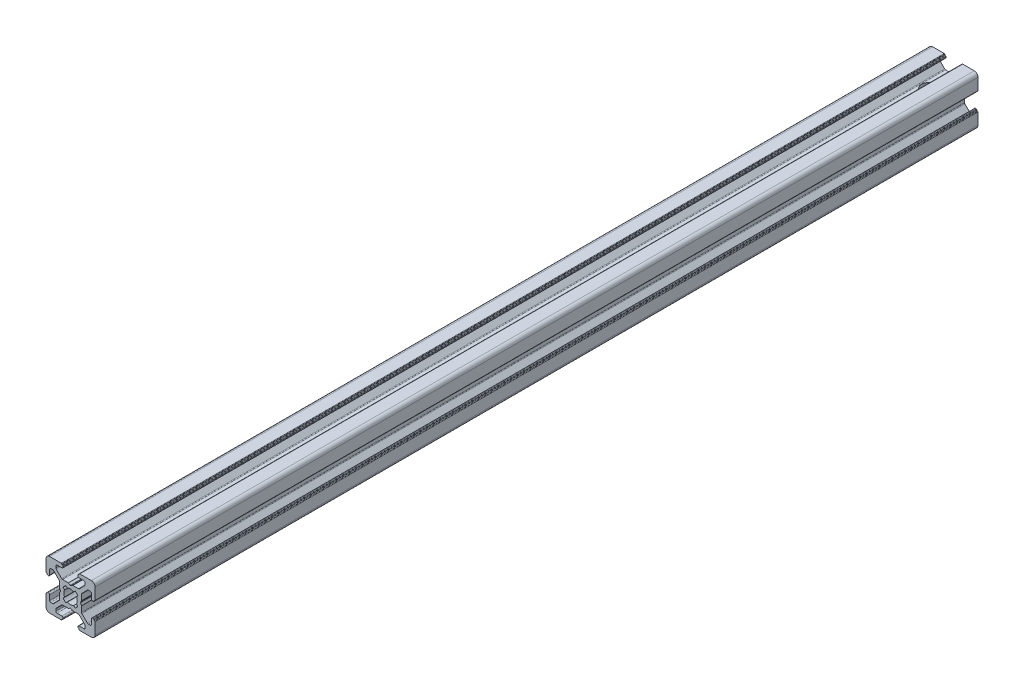
from build123d import *

# Parameters (mm, degrees)
Y_KSEKLIK_EKSTR_ZYON1_DEPTH = 180
IZIM2_R                     = 3
KES_EKSTR_ZYON1_DEPTH       = 36


with BuildPart() as part:
    # Çizim1 → Yükseklik-Ekstrüzyon1 (new, symmetric)
    with BuildSketch(Plane.XY):
        with BuildLine():
            Line((-3.750000227, 10), (-8.5, 10))
            ThreePointArc((-8.5, 10), (-9.560660172, 9.560660172), (-10, 8.5))
            Line((-10, 8.5), (-10, 3.749999605))
            ThreePointArc((-10, 3.749999605), (-9.941421356, 3.608578248), (-9.8, 3.549999605))
            Line((-9.8, 3.549999605), (-9.699999732, 3.549999605))
            ThreePointArc((-9.699999732, 3.549999605), (-9.558578376, 3.491420961), (-9.499999732, 3.349999605))
            Line((-9.499999732, 3.349999605), (-9.499999732, 3.2))
            ThreePointArc((-9.499999732, 3.2), (-9.441421088, 3.058578644), (-9.299999732, 3))
            Line((-9.299999732, 3), (-8.999999732, 3))
            ThreePointArc((-8.999999732, 3), (-8.646446341, 3.146446609), (-8.499999732, 3.5))
            Line((-8.499999732, 3.5), (-8.499999732, 5.499999605))
            ThreePointArc((-8.499999732, 5.499999605), (-8.353553123, 5.853552995), (-7.999999732, 5.999999605))
            Line((-7.999999732, 5.999999605), (-7.267766685, 5.999999605))
            ThreePointArc((-7.267766685, 5.999999605), (-7.076424969, 5.961939371), (-6.914213294, 5.853552995))
            Line((-6.914213294, 5.853552995), (-4.646446398, 3.585786099))
            ThreePointArc((-4.646446398, 3.585786099), (-4.538060023, 3.423574425), (-4.499999789, 3.232232709))
            Line((-4.499999789, 3.232232709), (-4.499999789, 0.953589302))
            ThreePointArc((-4.499999789, 0.953589302), (-4.493184953, 0.90182549), (-4.473204867, 0.853589298))
            Line((-4.473204867, 0.853589298), (-4.038119841, 0.099999969))
            ThreePointArc((-4.038119841, 0.099999969), (-4.011324929, 0), (-4.038119841, -0.099999969))
            Line((-4.038119841, -0.099999969), (-4.473204867, -0.853589297))
            ThreePointArc((-4.473204867, -0.853589297), (-4.493184953, -0.90182549), (-4.499999789, -0.953589302))
            Line((-4.499999789, -0.953589302), (-4.499999789, -3.232232708))
            ThreePointArc((-4.499999789, -3.232232708), (-4.538060023, -3.423574425), (-4.646446398, -3.585786099))
            Line((-4.646446398, -3.585786099), (-6.914213294, -5.853552995))
            ThreePointArc((-6.914213294, -5.853552995), (-7.076424969, -5.961939371), (-7.267766685, -5.999999605))
            Line((-7.267766685, -5.999999605), (-7.999999732, -5.999999605))
            ThreePointArc((-7.999999732, -5.999999605), (-8.353553123, -5.853552995), (-8.499999732, -5.499999605))
            Line((-8.499999732, -5.499999605), (-8.499999732, -3.5))
            ThreePointArc((-8.499999732, -3.5), (-8.646446341, -3.146446609), (-8.999999732, -3))
            Line((-8.999999732, -3), (-9.299999732, -3))
            ThreePointArc((-9.299999732, -3), (-9.441421088, -3.058578644), (-9.499999732, -3.2))
            Line((-9.499999732, -3.2), (-9.499999732, -3.349999605))
            ThreePointArc((-9.499999732, -3.349999605), (-9.558578376, -3.491420961), (-9.699999732, -3.549999605))
            Line((-9.699999732, -3.549999605), (-9.8, -3.549999605))
            ThreePointArc((-9.8, -3.549999605), (-9.941421356, -3.608578248), (-10, -3.749999605))
            Line((-10, -3.749999605), (-10, -8.5))
            ThreePointArc((-10, -8.5), (-9.560660172, -9.560660172), (-8.5, -10))
            Line((-8.5, -10), (-3.750000227, -10))
            ThreePointArc((-3.750000227, -10), (-3.608578871, -9.941421356), (-3.550000227, -9.8))
            Line((-3.550000227, -9.8), (-3.550000227, -9.7))
            ThreePointArc((-3.550000227, -9.7), (-3.491421584, -9.558578644), (-3.350000227, -9.5))
            Line((-3.350000227, -9.5), (-3.2, -9.5))
            ThreePointArc((-3.2, -9.5), (-3.058578644, -9.441421356), (-3, -9.3))
            Line((-3, -9.3), (-3, -8.999999673))
            ThreePointArc((-3, -8.999999673), (-3.146446609, -8.646446283), (-3.5, -8.499999673))
            Line((-3.5, -8.499999673), (-5.500000686, -8.499999673))
            ThreePointArc((-5.500000686, -8.499999673), (-5.853554077, -8.353553064), (-6.000000686, -7.999999673))
            Line((-6.000000686, -7.999999673), (-6.000000686, -7.267766626))
            ThreePointArc((-6.000000686, -7.267766626), (-5.961940448, -7.076424899), (-5.853554059, -6.914213219))
            Line((-5.853554059, -6.914213219), (-3.585787212, -4.646446592))
            ThreePointArc((-3.585787212, -4.646446592), (-3.423575544, -4.538060229), (-3.232233839, -4.5))
            Line((-3.232233839, -4.5), (-0.953590312, -4.5))
            ThreePointArc((-0.953590312, -4.5), (-0.901826505, -4.493185166), (-0.853590316, -4.473205083))
            Line((-0.853590316, -4.473205083), (-0.100000045, -4.038119562))
            ThreePointArc((-0.100000045, -4.038119562), (0, -4.011324632), (0.100000045, -4.038119562))
            Line((0.100000045, -4.038119562), (0.853590316, -4.473205083))
            ThreePointArc((0.853590316, -4.473205083), (0.901826505, -4.493185166), (0.953590312, -4.5))
            Line((0.953590312, -4.5), (3.232233839, -4.5))
            ThreePointArc((3.232233839, -4.5), (3.423575544, -4.538060229), (3.585787212, -4.646446592))
            Line((3.585787212, -4.646446592), (5.853554059, -6.914213218))
            ThreePointArc((5.853554059, -6.914213218), (5.961940448, -7.076424899), (6.000000686, -7.267766626))
            Line((6.000000686, -7.267766626), (6.000000686, -7.999999673))
            ThreePointArc((6.000000686, -7.999999673), (5.853554077, -8.353553064), (5.500000686, -8.499999673))
            Line((5.500000686, -8.499999673), (3.5, -8.499999673))
            ThreePointArc((3.5, -8.499999673), (3.146446609, -8.646446283), (3, -8.999999673))
            Line((3, -8.999999673), (3, -9.3))
            ThreePointArc((3, -9.3), (3.058578644, -9.441421356), (3.2, -9.5))
            Line((3.2, -9.5), (3.350000228, -9.5))
            ThreePointArc((3.350000228, -9.5), (3.491421584, -9.558578644), (3.550000228, -9.7))
            Line((3.550000228, -9.7), (3.550000228, -9.8))
            ThreePointArc((3.550000228, -9.8), (3.608578871, -9.941421356), (3.750000228, -10))
            Line((3.750000228, -10), (8.5, -10))
            ThreePointArc((8.5, -10), (9.560660172, -9.560660172), (10, -8.5))
            Line((10, -8.5), (10, -3.749999605))
            ThreePointArc((10, -3.749999605), (9.941421356, -3.608578248), (9.8, -3.549999605))
            Line((9.8, -3.549999605), (9.699999732, -3.549999605))
            ThreePointArc((9.699999732, -3.549999605), (9.558578376, -3.491420961), (9.499999732, -3.349999605))
            Line((9.499999732, -3.349999605), (9.499999732, -3.2))
            ThreePointArc((9.499999732, -3.2), (9.441421088, -3.058578644), (9.299999732, -3))
            Line((9.299999732, -3), (8.999999732, -3))
            ThreePointArc((8.999999732, -3), (8.646446341, -3.146446609), (8.499999732, -3.5))
            Line((8.499999732, -3.5), (8.499999732, -5.499999605))
            ThreePointArc((8.499999732, -5.499999605), (8.353553123, -5.853552995), (7.999999732, -5.999999605))
            Line((7.999999732, -5.999999605), (7.267766685, -5.999999605))
            ThreePointArc((7.267766685, -5.999999605), (7.076424969, -5.961939371), (6.914213294, -5.853552995))
            Line((6.914213294, -5.853552995), (4.646446398, -3.585786099))
            ThreePointArc((4.646446398, -3.585786099), (4.538060023, -3.423574425), (4.499999789, -3.232232708))
            Line((4.499999789, -3.232232708), (4.499999789, -0.953589302))
            ThreePointArc((4.499999789, -0.953589302), (4.493184953, -0.90182549), (4.473204867, -0.853589297))
            Line((4.473204867, -0.853589297), (4.038119841, -0.099999969))
            ThreePointArc((4.038119841, -0.099999969), (4.011324929, 0), (4.038119841, 0.099999969))
            Line((4.038119841, 0.099999969), (4.473204867, 0.853589298))
            ThreePointArc((4.473204867, 0.853589298), (4.493184953, 0.90182549), (4.499999789, 0.953589302))
            Line((4.499999789, 0.953589302), (4.499999789, 3.232232709))
            ThreePointArc((4.499999789, 3.232232709), (4.538060023, 3.423574425), (4.646446398, 3.585786099))
            Line((4.646446398, 3.585786099), (6.914213294, 5.853552995))
            ThreePointArc((6.914213294, 5.853552995), (7.076424969, 5.961939371), (7.267766685, 5.999999605))
            Line((7.267766685, 5.999999605), (7.999999732, 5.999999605))
            ThreePointArc((7.999999732, 5.999999605), (8.353553123, 5.853552995), (8.499999732, 5.499999605))
            Line((8.499999732, 5.499999605), (8.499999732, 3.5))
            ThreePointArc((8.499999732, 3.5), (8.646446341, 3.146446609), (8.999999732, 3))
            Line((8.999999732, 3), (9.299999732, 3))
            ThreePointArc((9.299999732, 3), (9.441421088, 3.058578644), (9.499999732, 3.2))
            Line((9.499999732, 3.2), (9.499999732, 3.349999605))
            ThreePointArc((9.499999732, 3.349999605), (9.558578376, 3.491420961), (9.699999732, 3.549999605))
            Line((9.699999732, 3.549999605), (9.8, 3.549999605))
            ThreePointArc((9.8, 3.549999605), (9.941421356, 3.608578248), (10, 3.749999605))
            Line((10, 3.749999605), (10, 8.5))
            ThreePointArc((10, 8.5), (9.560660172, 9.560660172), (8.5, 10))
            Line((8.5, 10), (3.750000228, 10))
            ThreePointArc((3.750000228, 10), (3.608578871, 9.941421356), (3.550000228, 9.8))
            Line((3.550000228, 9.8), (3.550000228, 9.7))
            ThreePointArc((3.550000228, 9.7), (3.491421584, 9.558578644), (3.350000228, 9.5))
            Line((3.350000228, 9.5), (3.2, 9.5))
            ThreePointArc((3.2, 9.5), (3.058578644, 9.441421356), (3, 9.3))
            Line((3, 9.3), (3, 8.999999673))
            ThreePointArc((3, 8.999999673), (3.146446609, 8.646446283), (3.5, 8.499999673))
            Line((3.5, 8.499999673), (5.500000686, 8.499999673))
            ThreePointArc((5.500000686, 8.499999673), (5.853554077, 8.353553064), (6.000000686, 7.999999673))
            Line((6.000000686, 7.999999673), (6.000000686, 7.267766626))
            ThreePointArc((6.000000686, 7.267766626), (5.961940448, 7.076424899), (5.853554059, 6.914213219))
            Line((5.853554059, 6.914213219), (3.585787212, 4.646446592))
            ThreePointArc((3.585787212, 4.646446592), (3.423575544, 4.538060229), (3.232233839, 4.5))
            Line((3.232233839, 4.5), (0.953590312, 4.5))
            ThreePointArc((0.953590312, 4.5), (0.901826505, 4.493185166), (0.853590316, 4.473205083))
            Line((0.853590316, 4.473205083), (0.100000045, 4.038119562))
            ThreePointArc((0.100000045, 4.038119562), (0, 4.011324632), (-0.100000045, 4.038119562))
            Line((-0.100000045, 4.038119562), (-0.853590316, 4.473205083))
            ThreePointArc((-0.853590316, 4.473205083), (-0.901826505, 4.493185166), (-0.953590312, 4.5))
            Line((-0.953590312, 4.5), (-3.232233839, 4.5))
            ThreePointArc((-3.232233839, 4.5), (-3.423575544, 4.538060229), (-3.585787212, 4.646446592))
            Line((-3.585787212, 4.646446592), (-5.853554059, 6.914213219))
            ThreePointArc((-5.853554059, 6.914213219), (-5.961940448, 7.076424899), (-6.000000686, 7.267766626))
            Line((-6.000000686, 7.267766626), (-6.000000686, 7.999999673))
            ThreePointArc((-6.000000686, 7.999999673), (-5.853554077, 8.353553064), (-5.500000686, 8.499999673))
            Line((-5.500000686, 8.499999673), (-3.5, 8.499999673))
            ThreePointArc((-3.5, 8.499999673), (-3.146446609, 8.646446283), (-3, 8.999999673))
            Line((-3, 8.999999673), (-3, 9.3))
            ThreePointArc((-3, 9.3), (-3.058578644, 9.441421356), (-3.2, 9.5))
            Line((-3.2, 9.5), (-3.350000227, 9.5))
            ThreePointArc((-3.350000227, 9.5), (-3.491421584, 9.558578644), (-3.550000227, 9.7))
            Line((-3.550000227, 9.7), (-3.550000227, 9.8))
            ThreePointArc((-3.550000227, 9.8), (-3.608578871, 9.941421356), (-3.750000227, 10))
        make_face()
        with BuildLine():
            Line((-2.992174953, 1.909930962), (-2.445295424, 1.258185317))
            ThreePointArc((-2.445295424, 1.258185317), (-2.75, 0), (-2.445295424, -1.258185317))
            Line((-2.445295424, -1.258185317), (-2.992174953, -1.909930962))
            ThreePointArc((-2.992174953, -1.909930962), (-2.511737261, -2.508410485), (-1.913895019, -2.989640962))
            Line((-1.913895019, -2.989640962), (-1.258185436, -2.445295362))
            ThreePointArc((-1.258185436, -2.445295362), (0, -2.75), (1.258185436, -2.445295362))
            Line((1.258185436, -2.445295362), (1.91389502, -2.989640962))
            ThreePointArc((1.91389502, -2.989640962), (2.511737261, -2.508410485), (2.992174953, -1.909930962))
            Line((2.992174953, -1.909930962), (2.445295424, -1.258185317))
            ThreePointArc((2.445295424, -1.258185317), (2.75, 0), (2.445295424, 1.258185317))
            Line((2.445295424, 1.258185317), (2.992174953, 1.909930962))
            ThreePointArc((2.992174953, 1.909930962), (2.511737261, 2.508410485), (1.91389502, 2.989640962))
            Line((1.91389502, 2.989640962), (1.258185436, 2.445295362))
            ThreePointArc((1.258185436, 2.445295362), (0, 2.75), (-1.258185436, 2.445295362))
            Line((-1.258185436, 2.445295362), (-1.913895019, 2.989640962))
            ThreePointArc((-1.913895019, 2.989640962), (-2.511737261, 2.508410485), (-2.992174953, 1.909930962))
        make_face(mode=Mode.SUBTRACT)
    extrude(amount=Y_KSEKLIK_EKSTR_ZYON1_DEPTH, both=True)

    # Çizim2 → Kes-Ekstrüzyon1 (cut)
    with BuildSketch(Plane(origin=(0, 10, 0), x_dir=(1, 0, 0), z_dir=(0, 1, 0))):
        with Locations(Location((0, 170, 0), (0, 0, 271.910214024))):
            Circle(IZIM2_R)
    extrude(amount=-KES_EKSTR_ZYON1_DEPTH, mode=Mode.SUBTRACT)


solid = part.part
